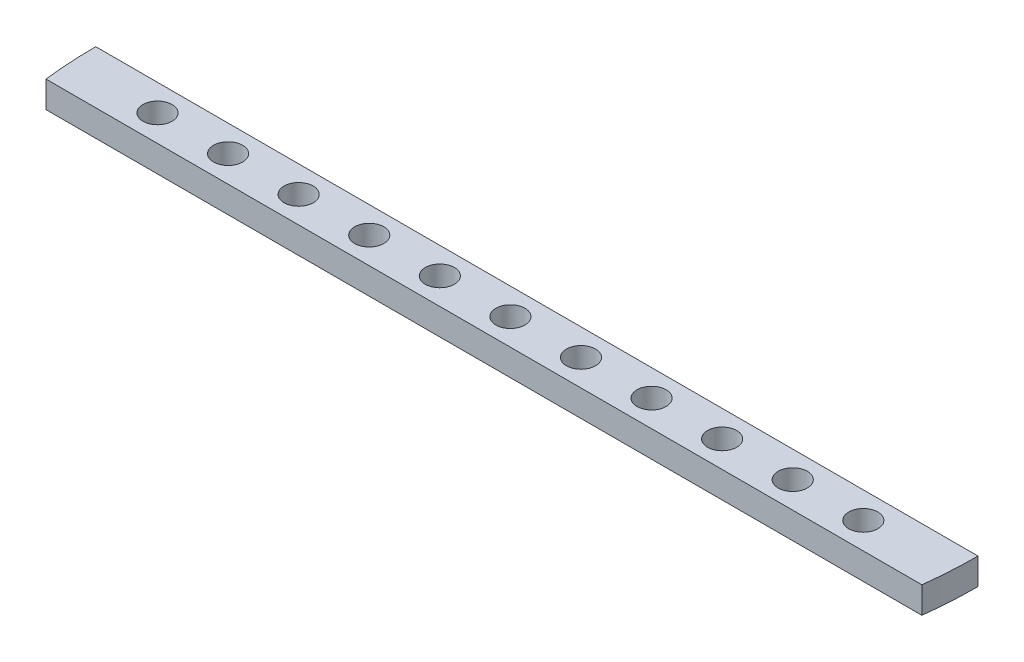
from build123d import *

# Parameters (mm, degrees)
EXTRUDE_1_DEPTH     = 4
CUT_EXTRUDE_1_DEPTH = 10
SKETCH_3_R          = 2.25
CUT_EXTRUDE_2_DEPTH = 10
SKETCH_4_R          = 1.65
CUT_EXTRUDE_3_DEPTH = 10
SKETCH_5_R          = 2.25
SKETCH_5_W          = 40
SKETCH_5_H          = 20
CUT_EXTRUDE_4_DEPTH = 10
CUT_EXTRUDE_6_DEPTH = 10
CUT_EXTRUDE_START   = -10
CUT_EXTRUDE_7_DEPTH = 10


with BuildPart() as part:
    # 草图1 → 凸台-拉伸1 (new body)
    with BuildSketch(Plane(origin=(0, 0, 0), x_dir=(1, 0, 0), z_dir=(0, 1, 0))):
        with BuildLine():
            Line((-50, 0), (50, 0))
            ThreePointArc((50, 0), (0, -50), (-50, 0))
        make_face()
    extrude(amount=EXTRUDE_1_DEPTH)

    # 草图2 → 切除-拉伸1 (cut)
    with BuildSketch(Plane(origin=(0, 4, 0), x_dir=(1, 0, 0), z_dir=(0, 1, 0))):
        Polygon((0, -10.623043888), (10, -10.623043888), (10, -30.623043888), (-30, -30.623043888), (-30, -10.623043888), align=None)
    extrude(amount=-CUT_EXTRUDE_1_DEPTH, mode=Mode.SUBTRACT)

    # 草图3 → 切除-拉伸2 (cut)
    with BuildSketch(Plane(origin=(0, 4, 0), x_dir=(1, 0, 0), z_dir=(0, 1, 0))):
        with Locations(Location((-34.75, -15.623043888, 0), (0, 0, 270))):
            Circle(SKETCH_3_R)
        with Locations(Location((-34.75, -25.623043888, 0), (0, 0, 270))):
            Circle(SKETCH_3_R)
        with Locations(Location((14.75, -25.623043888, 0), (0, 0, 90))):
            Circle(SKETCH_3_R)
        with Locations(Location((14.75, -15.623043888, 0), (0, 0, 90))):
            Circle(SKETCH_3_R)
    extrude(amount=-CUT_EXTRUDE_2_DEPTH, mode=Mode.SUBTRACT)

    # 草图4 → 切除-拉伸3 (cut)
    with BuildSketch(Plane(origin=(0, 4, 0), x_dir=(1, 0, 0), z_dir=(0, 1, 0))):
        with Locations(Location((0, -3, 0), (0, 0, 270))):
            Circle(SKETCH_4_R)
        with Locations(Location((8, -3, 0), (0, 0, 270))):
            Circle(SKETCH_4_R)
        with Locations(Location((16, -3, 0), (0, 0, 270))):
            Circle(SKETCH_4_R)
        with Locations(Location((24, -3, 0), (0, 0, 270))):
            Circle(SKETCH_4_R)
        with Locations(Location((32, -3, 0), (0, 0, 270))):
            Circle(SKETCH_4_R)
        with Locations(Location((40, -3, 0), (0, 0, 270))):
            Circle(SKETCH_4_R)
        with Locations(Location((-40, -3, 0), (0, 0, 90))):
            Circle(SKETCH_4_R)
        with Locations(Location((-32, -3, 0), (0, 0, 90))):
            Circle(SKETCH_4_R)
        with Locations(Location((-24, -3, 0), (0, 0, 90))):
            Circle(SKETCH_4_R)
        with Locations(Location((-16, -3, 0), (0, 0, 90))):
            Circle(SKETCH_4_R)
        with Locations(Location((-8, -3, 0), (0, 0, 90))):
            Circle(SKETCH_4_R)
    extrude(amount=-CUT_EXTRUDE_3_DEPTH, mode=Mode.SUBTRACT)

    # 草图5 → 切除-拉伸4 (cut)
    with BuildSketch(Plane(origin=(0, 4, 0), x_dir=(1, 0, 0), z_dir=(0, 1, 0))):
        with BuildLine():
            Line((49.355850717, -8), (0, -8))
            Line((0, -8), (-49.355850717, -8))
            ThreePointArc((-49.355850717, -8), (0, -50), (49.355850717, -8))
        make_face()
        with Locations((-34.75, -25.623043888)):
            Circle(SKETCH_5_R, mode=Mode.SUBTRACT)
        with Locations((-10, -20.623043888)):
            Rectangle(SKETCH_5_W, SKETCH_5_H, mode=Mode.SUBTRACT)
        with Locations((-34.75, -15.623043888)):
            Circle(SKETCH_5_R, mode=Mode.SUBTRACT)
        with Locations((14.75, -25.623043888)):
            Circle(SKETCH_5_R, mode=Mode.SUBTRACT)
        with Locations((14.75, -15.623043888)):
            Circle(SKETCH_5_R, mode=Mode.SUBTRACT)
    extrude(amount=-CUT_EXTRUDE_4_DEPTH, mode=Mode.SUBTRACT)

    # 草图7 → 切除-拉伸6 (cut)
    with BuildSketch(Plane(origin=(0, 0, 0), x_dir=(-1, 0, 0), z_dir=(0, 0, -1))):
        Polygon((-50, 4), (-50, 3), (50, 3), (50, 4), (49.677925359, 4), align=None)
    extrude(amount=-CUT_EXTRUDE_6_DEPTH, mode=Mode.SUBTRACT)

    # 草图8 → 切除-拉伸7 (cut)
    with BuildSketch(Plane(origin=(0, 3, 0), x_dir=(1, 0, 0), z_dir=(0, 1, 0)).offset(CUT_EXTRUDE_START)):
        with BuildLine():
            Line((49.638694584, -6), (0, -6))
            Line((0, -6), (-49.638694584, -6))
            ThreePointArc((-49.638694584, -6), (-49.507373187, -7.001428437), (-49.355850717, -8))
            Line((-49.355850717, -8), (49.355850717, -8))
            ThreePointArc((49.355850717, -8), (49.507373187, -7.001428437), (49.638694584, -6))
        make_face()
    extrude(amount=CUT_EXTRUDE_7_DEPTH, mode=Mode.SUBTRACT)


solid = part.part
